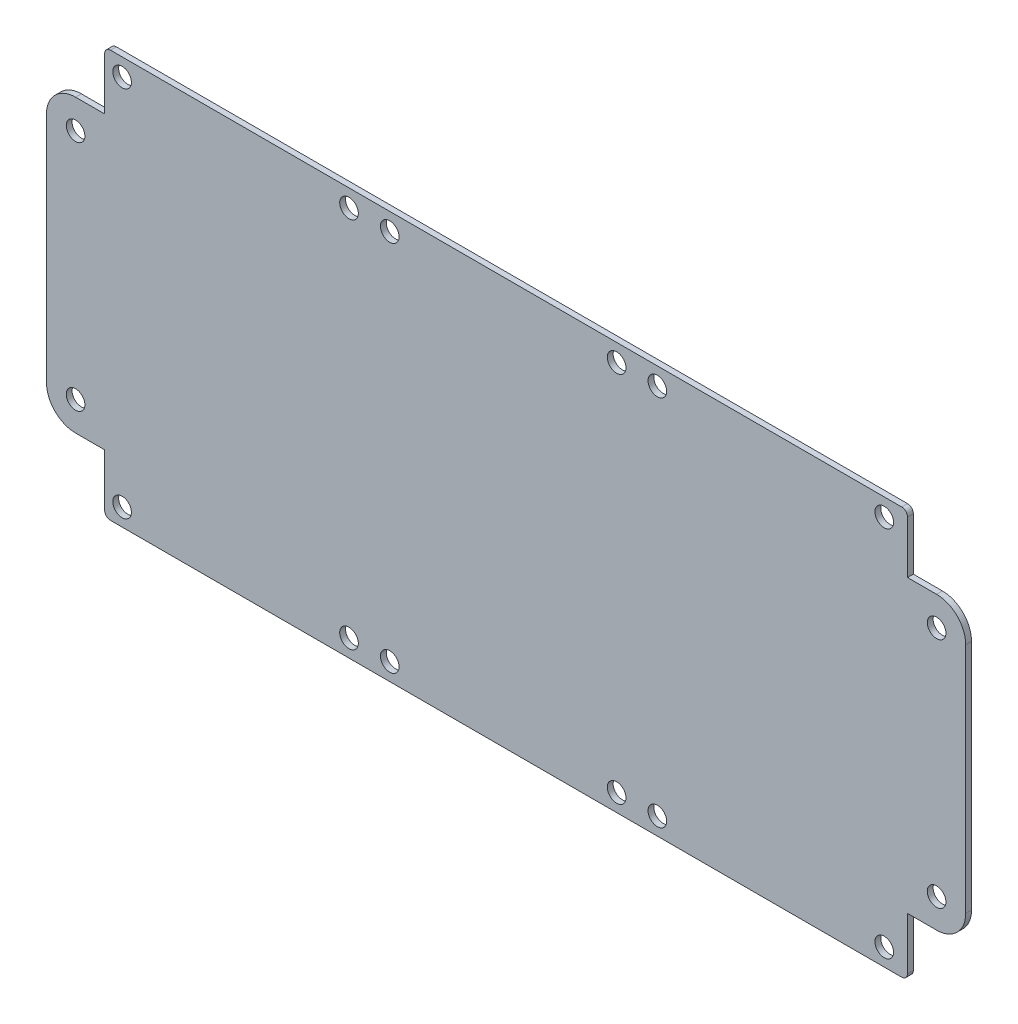
from build123d import *

# Parameters (mm, degrees)
SKETCH1_R           = 1.6
BOSS_EXTRUDE1_DEPTH = 1


with BuildPart() as part:
    # Sketch1 → Boss-Extrude1 (new body)
    with BuildSketch(Plane.XY):
        with BuildLine():
            Line((110.085666764, -21.015048426), (110.085666764, -30.015048426))
            ThreePointArc((110.085666764, -30.015048426), (109.792773545, -30.722155207), (109.085666764, -31.015048426))
            Line((109.085666764, -31.015048426), (-26.914333236, -31.015048426))
            ThreePointArc((-26.914333236, -31.015048426), (-27.621440018, -30.722155207), (-27.914333236, -30.015048426))
            Line((-27.914333236, -30.015048426), (-27.914333236, -21.015048426))
            Line((-27.914333236, -21.015048426), (-32.914333236, -21.015048426))
            ThreePointArc((-32.914333236, -21.015048426), (-36.449867142, -19.550582332), (-37.914333236, -16.015048426))
            Line((-37.914333236, -16.015048426), (-37.914333236, 23.984951574))
            ThreePointArc((-37.914333236, 23.984951574), (-36.449867142, 27.52048548), (-32.914333236, 28.984951574))
            Line((-32.914333236, 28.984951574), (-27.914333236, 28.984951574))
            Line((-27.914333236, 28.984951574), (-27.914333236, 37.984951574))
            ThreePointArc((-27.914333236, 37.984951574), (-27.621440018, 38.692058356), (-26.914333236, 38.984951574))
            Line((-26.914333236, 38.984951574), (109.085666764, 38.984951574))
            ThreePointArc((109.085666764, 38.984951574), (109.792773545, 38.692058356), (110.085666764, 37.984951574))
            Line((110.085666764, 37.984951574), (110.085666764, 28.984951574))
            Line((110.085666764, 28.984951574), (115.085666764, 28.984951574))
            ThreePointArc((115.085666764, 28.984951574), (118.62120067, 27.52048548), (120.085666764, 23.984951574))
            Line((120.085666764, 23.984951574), (120.085666764, -16.015048426))
            ThreePointArc((120.085666764, -16.015048426), (118.62120067, -19.550582332), (115.085666764, -21.015048426))
            Line((115.085666764, -21.015048426), (110.085666764, -21.015048426))
        make_face()
        with Locations((-24.914333236, 35.984951574)):
            Circle(SKETCH1_R, mode=Mode.SUBTRACT)
        with Locations((14.085666764, 35.984951574)):
            Circle(SKETCH1_R, mode=Mode.SUBTRACT)
        with Locations((-24.914333236, -28.015048426)):
            Circle(SKETCH1_R, mode=Mode.SUBTRACT)
        with Locations((14.085666764, -28.015048426)):
            Circle(SKETCH1_R, mode=Mode.SUBTRACT)
        with Locations((21.085666764, 35.984951574)):
            Circle(SKETCH1_R, mode=Mode.SUBTRACT)
        with Locations((60.085666764, 35.984951574)):
            Circle(SKETCH1_R, mode=Mode.SUBTRACT)
        with Locations((60.085666764, -28.015048426)):
            Circle(SKETCH1_R, mode=Mode.SUBTRACT)
        with Locations((21.085666764, -28.015048426)):
            Circle(SKETCH1_R, mode=Mode.SUBTRACT)
        with Locations((67.085666764, 35.984951574)):
            Circle(SKETCH1_R, mode=Mode.SUBTRACT)
        with Locations((106.085666764, 35.984951574)):
            Circle(SKETCH1_R, mode=Mode.SUBTRACT)
        with Locations((106.085666764, -28.015048426)):
            Circle(SKETCH1_R, mode=Mode.SUBTRACT)
        with Locations((67.085666764, -28.015048426)):
            Circle(SKETCH1_R, mode=Mode.SUBTRACT)
        with Locations((-32.914333236, -16.015048426)):
            Circle(SKETCH1_R, mode=Mode.SUBTRACT)
        with Locations((-32.914333236, 23.984951574)):
            Circle(SKETCH1_R, mode=Mode.SUBTRACT)
        with Locations((115.085666764, 23.984951574)):
            Circle(SKETCH1_R, mode=Mode.SUBTRACT)
        with Locations((115.085666764, -16.015048426)):
            Circle(SKETCH1_R, mode=Mode.SUBTRACT)
    extrude(amount=BOSS_EXTRUDE1_DEPTH)


solid = part.part
